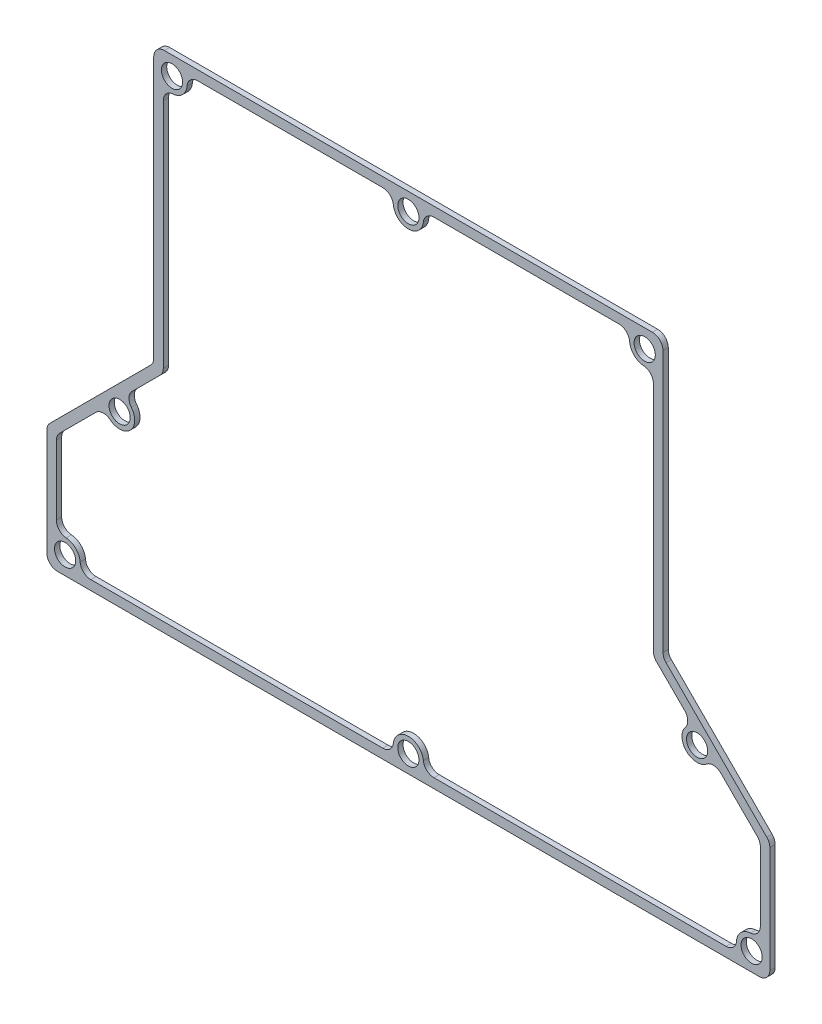
from build123d import *

# Parameters (mm, degrees)
SKETCH1_R           = 2
BOSS_EXTRUDE1_DEPTH = 1


with BuildPart() as part:
    # Sketch1 → Boss-Extrude1 (new body)
    with BuildSketch(Plane.XY):
        with BuildLine():
            Line((100.581340861, -63.068209116), (100.581340861, -13.788708514))
            ThreePointArc((100.581340861, -13.788708514), (99.995554423, -12.374494952), (98.581340861, -11.788708514))
            Line((98.581340861, -11.788708514), (6.526340861, -11.788708514))
            ThreePointArc((6.526340861, -11.788708514), (5.112127298, -12.374494952), (4.526340861, -13.788708514))
            Line((4.526340861, -13.788708514), (4.526340861, -63.063209116))
            ThreePointArc((4.526340861, -63.063209116), (4.374099926, -63.828575981), (3.940554423, -64.477422679))
            Line((3.940554423, -64.477422679), (-15.055177547, -83.473154649))
            ThreePointArc((-15.055177547, -83.473154649), (-15.48872305, -84.122001347), (-15.640963985, -84.887368211))
            Line((-15.640963985, -84.887368211), (-15.640963985, -104.958318205))
            ThreePointArc((-15.640963985, -104.958318205), (-15.055177547, -106.372531767), (-13.640963985, -106.958318205))
            Line((-13.640963985, -106.958318205), (118.743645706, -106.958318205))
            ThreePointArc((118.743645706, -106.958318205), (120.157859269, -106.372531767), (120.743645706, -104.958318205))
            Line((120.743645706, -104.958318205), (120.743645706, -84.887368211))
            ThreePointArc((120.743645706, -84.887368211), (120.591404771, -84.122001347), (120.157859269, -83.473154649))
            Line((120.157859269, -83.473154649), (101.167127298, -64.482422679))
            ThreePointArc((101.167127298, -64.482422679), (100.733581796, -63.833575981), (100.581340861, -63.068209116))
        make_face()
        with Locations((-12.195717461, -103.513071681)):
            Circle(SKETCH1_R, mode=Mode.SUBTRACT)
        with Locations((52.551340861, -103.658318205)):
            Circle(SKETCH1_R, mode=Mode.SUBTRACT)
        with Locations((117.297199097, -103.511871596)):
            Circle(SKETCH1_R, mode=Mode.SUBTRACT)
        with Locations((107.016568327, -74.998768464)):
            Circle(SKETCH1_R, mode=Mode.SUBTRACT)
        with Locations((-1.913886606, -74.998768464)):
            Circle(SKETCH1_R, mode=Mode.SUBTRACT)
        with Locations((7.97278747, -15.235155124)):
            Circle(SKETCH1_R, mode=Mode.SUBTRACT)
        with Locations((52.553840861, -15.088708514)):
            Circle(SKETCH1_R, mode=Mode.SUBTRACT)
        with Locations((97.134894251, -15.235155124)):
            Circle(SKETCH1_R, mode=Mode.SUBTRACT)
        with BuildLine():
            Line((98.781340861, -63.813793529), (98.781340861, -20.07225136))
            ThreePointArc((98.781340861, -20.07225136), (98.246194168, -18.710559476), (96.927136073, -18.0775725))
            ThreePointArc((96.927136073, -18.0775725), (95.119639925, -17.25040945), (94.292476875, -15.442913302))
            ThreePointArc((94.292476875, -15.442913302), (93.659489899, -14.123855207), (92.297798015, -13.588708514))
            Line((92.297798015, -13.588708514), (57.377998818, -13.588708514))
            ThreePointArc((57.377998818, -13.588708514), (56.03866524, -14.103385126), (55.388655331, -15.382522947))
            ThreePointArc((55.388655331, -15.382522947), (52.553840861, -17.938708514), (49.719026391, -15.382522947))
            ThreePointArc((49.719026391, -15.382522947), (49.069016481, -14.103385126), (47.729682903, -13.588708514))
            Line((47.729682903, -13.588708514), (12.809883707, -13.588708514))
            ThreePointArc((12.809883707, -13.588708514), (11.448191822, -14.123855207), (10.815204846, -15.442913302))
            ThreePointArc((10.815204846, -15.442913302), (9.988041797, -17.25040945), (8.180545648, -18.0775725))
            ThreePointArc((8.180545648, -18.0775725), (6.861487553, -18.710559476), (6.326340861, -20.07225136))
            Line((6.326340861, -20.07225136), (6.326340861, -63.808793529))
            ThreePointArc((6.326340861, -63.808793529), (6.174099926, -64.574160393), (5.740554423, -65.223007091))
            Line((5.740554423, -65.223007091), (0.436648028, -70.526913486))
            ThreePointArc((0.436648028, -70.526913486), (-0.146472505, -71.837896664), (0.298388107, -73.202010106))
            ThreePointArc((0.298388107, -73.202010106), (0.101367721, -77.01402279), (-3.710644963, -77.211043177))
            ThreePointArc((-3.710644963, -77.211043177), (-5.074758405, -76.766182564), (-6.385741583, -77.349303097))
            Line((-6.385741583, -77.349303097), (-13.255177547, -84.218739061))
            ThreePointArc((-13.255177547, -84.218739061), (-13.68872305, -84.867585759), (-13.840963985, -85.632952624))
            Line((-13.840963985, -85.632952624), (-13.840963985, -98.677765048))
            ThreePointArc((-13.840963985, -98.677765048), (-13.306003678, -100.039256399), (-11.987305288, -100.672403919))
            ThreePointArc((-11.987305288, -100.672403919), (-10.18166322, -101.49901744), (-9.355049698, -103.304659508))
            ThreePointArc((-9.355049698, -103.304659508), (-8.721902178, -104.623357898), (-7.360410828, -105.158318205))
            Line((-7.360410828, -105.158318205), (47.727182903, -105.158318205))
            ThreePointArc((47.727182903, -105.158318205), (49.066516481, -104.643641593), (49.716526391, -103.364503772))
            ThreePointArc((49.716526391, -103.364503772), (52.551340861, -100.808318205), (55.386155331, -103.364503772))
            ThreePointArc((55.386155331, -103.364503772), (56.03616524, -104.643641593), (57.375498818, -105.158318205))
            Line((57.375498818, -105.158318205), (112.46010286, -105.158318205))
            ThreePointArc((112.46010286, -105.158318205), (113.821794745, -104.623171513), (114.454781721, -103.304113418))
            ThreePointArc((114.454781721, -103.304113418), (115.28194477, -101.496617269), (117.089440919, -100.66945422))
            ThreePointArc((117.089440919, -100.66945422), (118.408499014, -100.036467243), (118.943645706, -98.674775359))
            Line((118.943645706, -98.674775359), (118.943645706, -85.632952624))
            ThreePointArc((118.943645706, -85.632952624), (118.791404771, -84.867585759), (118.357859269, -84.218739061))
            Line((118.357859269, -84.218739061), (111.488423304, -77.349303097))
            ThreePointArc((111.488423304, -77.349303097), (110.177440127, -76.766182564), (108.813326684, -77.211043177))
            ThreePointArc((108.813326684, -77.211043177), (105.001314001, -77.01402279), (104.804293614, -73.202010106))
            ThreePointArc((104.804293614, -73.202010106), (105.249154227, -71.837896664), (104.666033694, -70.526913486))
            Line((104.666033694, -70.526913486), (99.367127298, -65.228007091))
            ThreePointArc((99.367127298, -65.228007091), (98.933581796, -64.579160393), (98.781340861, -63.813793529))
        make_face(mode=Mode.SUBTRACT)
    extrude(amount=BOSS_EXTRUDE1_DEPTH)


solid = part.part
